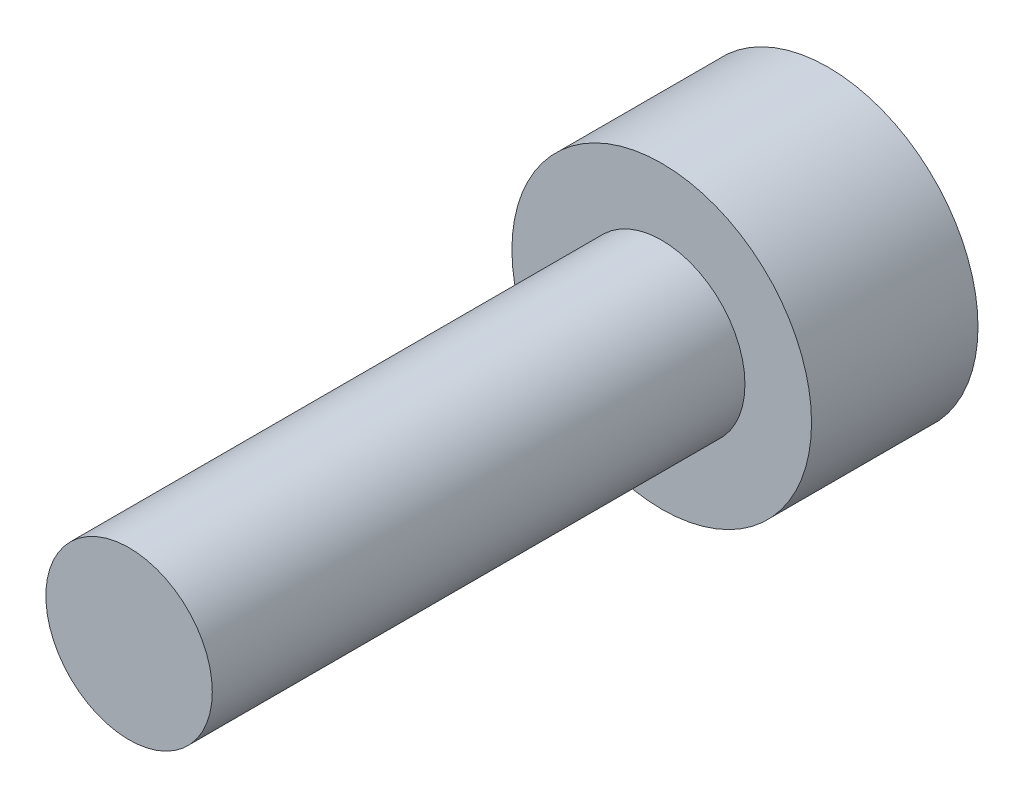
from build123d import *

# Parameters (mm, degrees)
CABEZA_START            = -2.5
SK_CABEZA_R             = 2.25
CABEZA_DEPTH            = 2.5
SK_CUERPO_R             = 1.25
CUERPO_DEPTH            = 8
HEXAGONO_INTERIOR_START = -2.5
HEXAGONO_INTERIOR_DEPTH = 1.25


with BuildPart() as part:
    # Sk_Cabeza → Cabeza (new body)
    with BuildSketch(Plane.XY.offset(CABEZA_START)):
        Circle(SK_CABEZA_R)
    extrude(amount=CABEZA_DEPTH)

    # Sk_Cuerpo → Cuerpo (add)
    with BuildSketch(Plane.XY):
        Circle(SK_CUERPO_R)
    extrude(amount=CUERPO_DEPTH)

    # Sk_Hexagono_interior → Hexagono_interior (cut)
    with BuildSketch(Plane.XY.offset(HEXAGONO_INTERIOR_START)):
        Polygon((0, -1.154700538), (1, -0.577350269), (1, 0.577350269), (0, 1.154700538), (-1, 0.577350269), (-1, -0.577350269), align=None)
    extrude(amount=HEXAGONO_INTERIOR_DEPTH, mode=Mode.SUBTRACT)


solid = part.part
